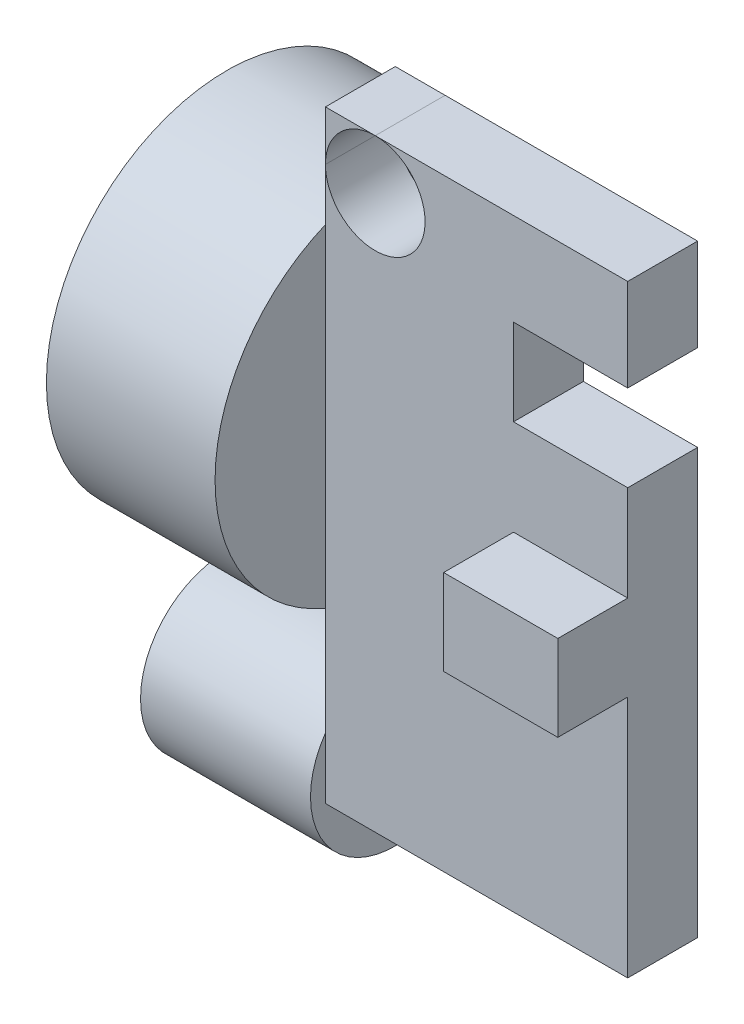
from build123d import *

# Parameters (mm, degrees)
SKETCH_1_W          = 43.254699728
SKETCH_1_H          = 86.319685861
EXTRUDE_1_DEPTH     = 10
SKETCH_2_W          = 24.135491712
SKETCH_2_H          = 25.789004645
SKETCH_3_W          = 24.320068761
SKETCH_3_H          = 12.136002186
SKETCH_4_W          = 16.340574455
SKETCH_4_H          = 12.354227472
CUT_EXTRUDE_1_DEPTH = 10
SKETCH_4_3_W        = 16.340574455
SKETCH_4_3_H        = 12.259920393
EXTRUDE_2_DEPTH     = 10
SKETCH_8_R          = 7.130638078
CUT_EXTRUDE_3_DEPTH = 10


with BuildPart() as part:
    # 草图1 → 凸台-拉伸1 (new body)
    with BuildSketch(Plane.XY):
        with Locations((21.627349864, 43.159842931)):
            Rectangle(SKETCH_1_W, SKETCH_1_H)
    extrude(amount=EXTRUDE_1_DEPTH)

    # 草图2 → 旋转3 (revolve)
    with BuildSketch(Plane.XY):
        with Locations((-12.067745856, 60.858179452)):
            Rectangle(SKETCH_2_W, SKETCH_2_H)
    revolve(axis=Axis((-24.135491712, 47.963677129, 0), (1, 0, 0)))

    # 草图3 → 旋转5 (revolve)
    with BuildSketch(Plane.XY):
        with Locations((-12.160034381, 7.931725474)):
            Rectangle(SKETCH_3_W, SKETCH_3_H)
    revolve(axis=Axis((-24.320068761, 1.863724381, 0), (1, 0, 0)))

    # 草图4 → 切除-拉伸1 (cut)
    with BuildSketch(Plane.XY.offset(10)):
        with Locations((35.084412501, 66.928824031)):
            Rectangle(SKETCH_4_W, SKETCH_4_H)
    extrude(amount=-CUT_EXTRUDE_1_DEPTH, mode=Mode.SUBTRACT)

    # 草图4<3> → 凸台-拉伸2 (add)
    with BuildSketch(Plane.XY.offset(10)):
        with Locations((35.084412501, 40.947223507)):
            Rectangle(SKETCH_4_3_W, SKETCH_4_3_H)
    extrude(amount=EXTRUDE_2_DEPTH)

    # 草图8 → 切除-拉伸3 (cut)
    with BuildSketch(Plane.XY.offset(10)):
        with Locations((7.130638078, 79.189047783)):
            Circle(SKETCH_8_R)
    extrude(amount=-CUT_EXTRUDE_3_DEPTH, mode=Mode.SUBTRACT)


with BuildPart() as cut_extrude_3_piece_1:
    # of the separate pieces the step leaves, piece 1, a body of its own (cut_extrude_3_pieces)
    add(part.part.solids().sort_by_distance((0, 0, 0))[0])


with BuildPart() as cut_extrude_3_piece_2:
    # of the separate pieces the step leaves, piece 2, a body of its own (cut_extrude_3_pieces)
    add(part.part.solids().sort_by_distance((0, 86.319685861, 0))[0])


solid = Compound([cut_extrude_3_piece_1.part, cut_extrude_3_piece_2.part])
